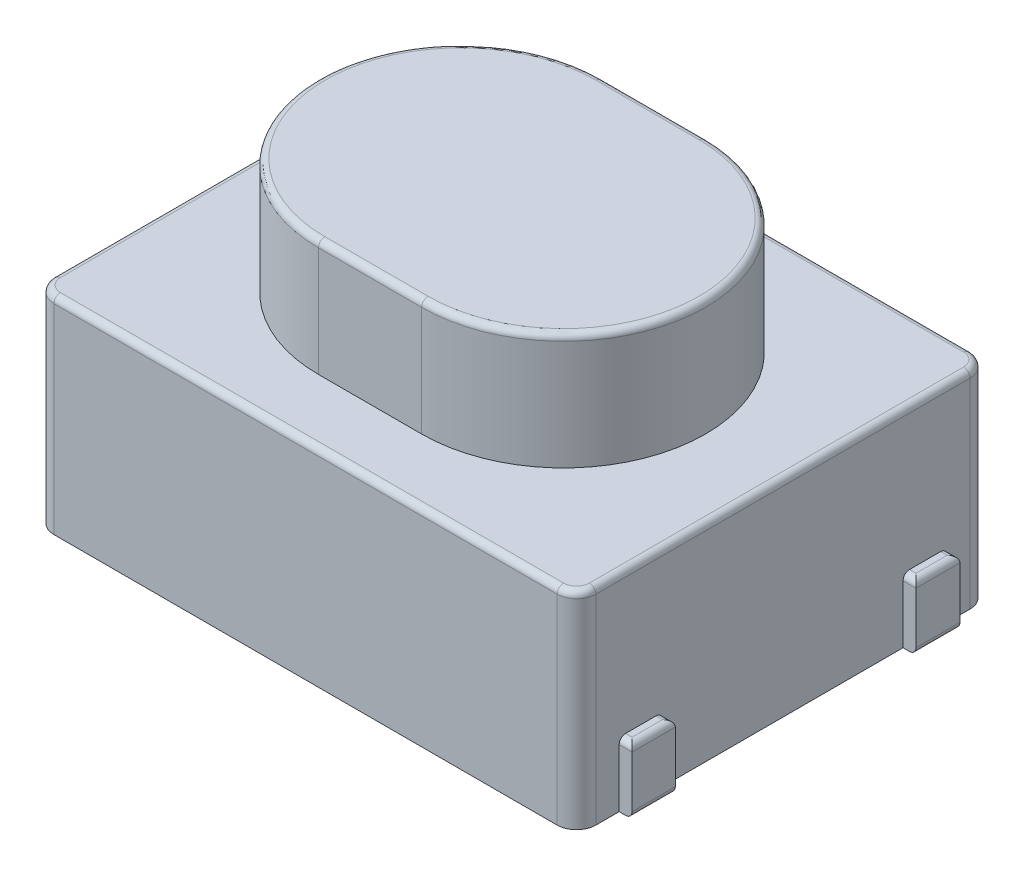
from build123d import *

# Parameters (mm, degrees)
BOSS_EXTRU_1_DEPTH = 1.6
BOSS_EXTRU_2_DEPTH = 0.9
CONG_1_R           = 0.05
ESQUISSE4_W        = 0.1
ESQUISSE4_H        = 0.34122062
ESQUISSE4_H_2      = 0.335337507
BOSS_EXTRU_3_DEPTH = 0.5
CONG_2_R           = 0.05
CONG_3_R           = 0.05
CONG_4_R           = 0.05
CONG_5_R           = 0.05
CONG_6_R           = 0.05


with BuildPart() as part:
    # Esquisse1 → Boss.-Extru.1 (new body)
    with BuildSketch(Plane(origin=(0, 0, 0), x_dir=(1, 0, 0), z_dir=(0, 1, 0))):
        with BuildLine():
            Line((0.15, 0), (4.05, 0))
            ThreePointArc((4.05, 0), (4.156066017, 0.043933983), (4.2, 0.15))
            Line((4.2, 0.15), (4.2, 3.05))
            ThreePointArc((4.2, 3.05), (4.156066017, 3.156066017), (4.05, 3.2))
            Line((4.05, 3.2), (0.15, 3.2))
            ThreePointArc((0.15, 3.2), (0.043933983, 3.156066017), (0, 3.05))
            Line((0, 3.05), (0, 0.15))
            ThreePointArc((0, 0.15), (0.043933983, 0.043933983), (0.15, 0))
        make_face()
    extrude(amount=BOSS_EXTRU_1_DEPTH)

    # Esquisse3 → Boss.-Extru.2 (add)
    with BuildSketch(Plane(origin=(0, 1.6, 0), x_dir=(1, 0, 0), z_dir=(0, 1, 0))):
        with BuildLine():
            Line((1.7, 2.7), (2.5, 2.7))
            ThreePointArc((2.5, 2.7), (3.6, 1.6), (2.5, 0.5))
            Line((2.5, 0.5), (1.7, 0.5))
            ThreePointArc((1.7, 0.5), (0.6, 1.6), (1.7, 2.7))
        make_face()
    extrude(amount=BOSS_EXTRU_2_DEPTH)

    # Congé1
    cong_1_edges = [part.edges().sort_by_distance(p)[0] for p in [
        (0.6, 2.5, -1.6),
        (2.1, 2.5, -0.5),
        (3.6, 2.5, -1.6),
        (2.1, 2.5, -2.7),
    ]]
    fillet(cong_1_edges, radius=CONG_1_R)

    # Esquisse4 → Boss.-Extru.3 (add)
    with BuildSketch(Plane(origin=(0, 0, 0), x_dir=(1, 0, 0), z_dir=(0, 1, 0))):
        with Locations((-0.05, 2.701361962)):
            Rectangle(ESQUISSE4_W, ESQUISSE4_H)
        with Locations((4.25, 2.701361962)):
            Rectangle(ESQUISSE4_W, ESQUISSE4_H)
        with Locations((-0.05, 0.498135713)):
            Rectangle(ESQUISSE4_W, ESQUISSE4_H_2)
        with Locations((4.25, 0.498135713)):
            Rectangle(ESQUISSE4_W, ESQUISSE4_H_2)
    extrude(amount=BOSS_EXTRU_3_DEPTH)

    # Congé2
    cong_2_edges = [part.edges().sort_by_distance(p)[0] for p in [
        (4.156066017, 1.6, -0.043933983),
        (4.2, 1.6, -1.6),
        (4.156066017, 1.6, -3.156066017),
        (2.1, 1.6, -3.2),
        (0.043933983, 1.6, -3.156066017),
        (0, 1.6, -1.6),
        (0.043933983, 1.6, -0.043933983),
        (2.1, 1.6, 0),
    ]]
    fillet(cong_2_edges, radius=CONG_2_R)

    # Congé3
    cong_3_edges = [part.edges().sort_by_distance(p)[0] for p in [
        (4.25, 0.5, -2.530751652),
        (4.3, 0.5, -2.701361962),
        (4.25, 0.5, -2.871972272),
        (4.25, 0.5, -0.330466959),
        (4.3, 0.5, -0.498135713),
        (4.25, 0.5, -0.665804466),
    ]]
    fillet(cong_3_edges, radius=CONG_3_R)

    # Congé4
    cong_4_edges = [part.edges().sort_by_distance(p)[0] for p in [
        (-0.05, 0.5, -2.871972272),
        (-0.1, 0.5, -2.701361962),
        (-0.05, 0.5, -2.530751652),
        (-0.05, 0.5, -0.665804466),
        (-0.1, 0.5, -0.498135713),
        (-0.05, 0.5, -0.330466959),
    ]]
    fillet(cong_4_edges, radius=CONG_4_R)

    # Congé5
    cong_5_edges = [part.edges().sort_by_distance(p)[0] for p in [
        (-0.1, 0, -2.701361962),
        (-0.1, 0, -0.498135713),
    ]]
    fillet(cong_5_edges, radius=CONG_5_R)

    # Congé6
    cong_6_edges = [part.edges().sort_by_distance(p)[0] for p in [
        (4.3, 0, -2.701361962),
        (4.3, 0, -0.498135713),
    ]]
    fillet(cong_6_edges, radius=CONG_6_R)


solid = part.part
